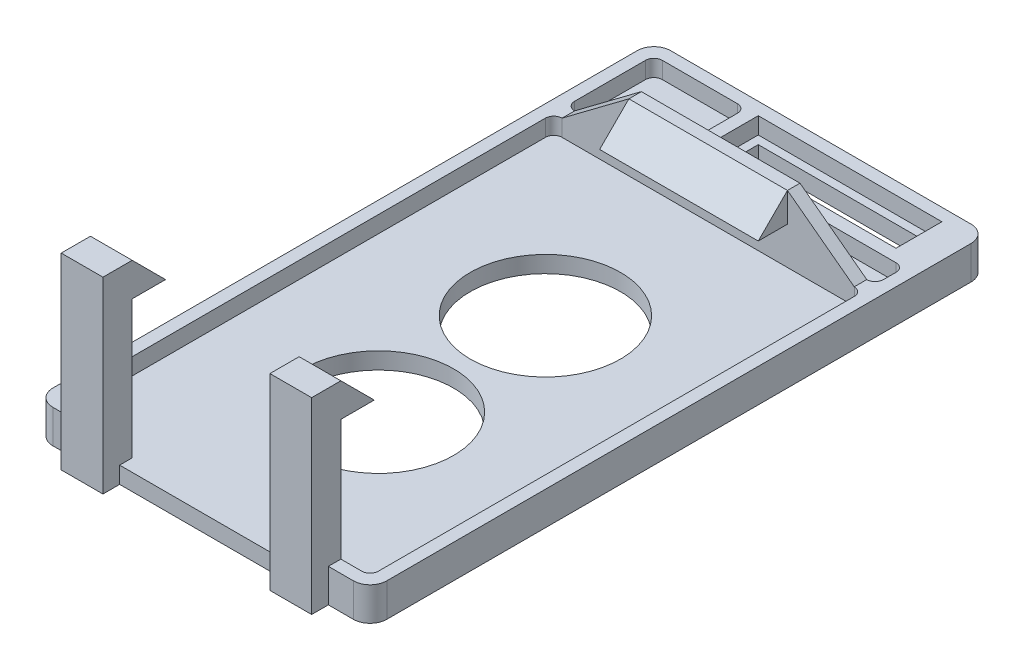
from build123d import *

# Parameters (mm, degrees)
BOSS_EXTRUDE1_DEPTH  = 1
PCB_HOLDER_52_R      = 4.5
BOSS_EXTRUDE2_DEPTH  = 1
BOSS_EXTRUDE3_DEPTH  = 2
PCB_HOLDER_57_W      = 17.5
PCB_HOLDER_57_H      = 0.75
BOSS_EXTRUDE7_DEPTH  = 5
SKETCH6_W            = 9.5
SKETCH6_H            = 1.75
BOSS_EXTRUDE9_DEPTH  = 1.75
CUT_EXTRUDE7_DEPTH   = 0.75
PCB_HOLDER_58_W      = 2.5
PCB_HOLDER_58_H      = 1
PCB_HOLDER_58_H_2    = 0.75
BOSS_EXTRUDE10_DEPTH = 11.25
SKETCH10_W           = 2.5
SKETCH10_H           = 2
BOSS_EXTRUDE11_DEPTH = 2
CUT_EXTRUDE8_DEPTH   = 15
CUT_EXTRUDE12_DEPTH  = 9.5
SKETCH12_W           = 11
SKETCH12_H           = 2.75
SKETCH12_W_2         = 10
SKETCH12_H_2         = 1.75
CUT_EXTRUDE15_DEPTH  = 1
SKETCH12_3_W         = 10
SKETCH12_3_H         = 1.75
CUT_EXTRUDE16_DEPTH  = 2


with BuildPart() as part:
    # PCB holder → Boss-Extrude1 (new body)
    with BuildSketch(Plane(origin=(0, 0, 0), x_dir=(1, 0, 0), z_dir=(0, 1, 0))):
        with BuildLine():
            Line((9, 21.5), (-9, 21.5))
            ThreePointArc((-9, 21.5), (-9.707106781, 21.207106781), (-10, 20.5))
            Line((-10, 20.5), (-10, -14.5))
            ThreePointArc((-10, -14.5), (-9.707106781, -15.207106781), (-9, -15.5))
            Line((-9, -15.5), (9, -15.5))
            ThreePointArc((9, -15.5), (9.707106781, -15.207106781), (10, -14.5))
            Line((10, -14.5), (10, 20.5))
            ThreePointArc((10, 20.5), (9.707106781, 21.207106781), (9, 21.5))
        make_face()
        with BuildLine():
            Line((9.25, 14.25), (9.25, -14.25))
            ThreePointArc((9.25, -14.25), (9.103553391, -14.603553391), (8.75, -14.75))
            Line((8.75, -14.75), (-8.75, -14.75))
            ThreePointArc((-8.75, -14.75), (-9.103553391, -14.603553391), (-9.25, -14.25))
            Line((-9.25, -14.25), (-9.25, 14.25))
            ThreePointArc((-9.25, 14.25), (-9.103553391, 14.603553391), (-8.75, 14.75))
            Line((-8.75, 14.75), (8.75, 14.75))
            ThreePointArc((8.75, 14.75), (9.103553391, 14.603553391), (9.25, 14.25))
        make_face(mode=Mode.SUBTRACT)
    extrude(amount=BOSS_EXTRUDE1_DEPTH)

    # PCB holder<52> → Boss-Extrude2 (add)
    with BuildSketch(Plane(origin=(0, 0, 0), x_dir=(1, 0, 0), z_dir=(0, 1, 0))):
        with BuildLine():
            Line((-9.25, 14.25), (-9.25, -14.25))
            ThreePointArc((-9.25, -14.25), (-9.103553391, -14.603553391), (-8.75, -14.75))
            Line((-8.75, -14.75), (8.75, -14.75))
            ThreePointArc((8.75, -14.75), (9.103553391, -14.603553391), (9.25, -14.25))
            Line((9.25, -14.25), (9.25, 14.25))
            ThreePointArc((9.25, 14.25), (9.103553391, 14.603553391), (8.75, 14.75))
            Line((8.75, 14.75), (-8.75, 14.75))
            ThreePointArc((-8.75, 14.75), (-9.103553391, 14.603553391), (-9.25, 14.25))
        make_face()
        with Locations(Location((0, -5, 0), (0, 0, 270))):
            Circle(PCB_HOLDER_52_R, mode=Mode.SUBTRACT)
        with Locations(Location((0, 5, 0), (0, 0, 270))):
            Circle(PCB_HOLDER_52_R, mode=Mode.SUBTRACT)
    extrude(amount=BOSS_EXTRUDE2_DEPTH)

    # PCB holder<55> → Boss-Extrude3 (add)
    with BuildSketch(Plane(origin=(0, 0, 0), x_dir=(1, 0, 0), z_dir=(0, 1, 0))):
        with BuildLine():
            Line((8.75, 15.5), (8.75, 14.75))
            ThreePointArc((8.75, 14.75), (9.103553391, 14.603553391), (9.25, 14.25))
            Line((9.25, 14.25), (9.25, -14.25))
            ThreePointArc((9.25, -14.25), (9.103553391, -14.603553391), (8.75, -14.75))
            Line((8.75, -14.75), (7.5, -14.75))
            Line((7.5, -14.75), (7.5, -15.5))
            Line((7.5, -15.5), (9, -15.5))
            ThreePointArc((9, -15.5), (9.707106781, -15.207106781), (10, -14.5))
            Line((10, -14.5), (10, 20.5))
            ThreePointArc((10, 20.5), (9.707106781, 21.207106781), (9, 21.5))
            Line((9, 21.5), (-9, 21.5))
            ThreePointArc((-9, 21.5), (-9.707106781, 21.207106781), (-10, 20.5))
            Line((-10, 20.5), (-10, -14.5))
            ThreePointArc((-10, -14.5), (-9.707106781, -15.207106781), (-9, -15.5))
            Line((-9, -15.5), (-7.5, -15.5))
            Line((-7.5, -15.5), (-7.5, -14.75))
            Line((-7.5, -14.75), (-8.75, -14.75))
            ThreePointArc((-8.75, -14.75), (-9.103553391, -14.603553391), (-9.25, -14.25))
            Line((-9.25, -14.25), (-9.25, 14.25))
            ThreePointArc((-9.25, 14.25), (-9.103553391, 14.603553391), (-8.75, 14.75))
            Line((-8.75, 14.75), (-8.75, 15.5))
            Line((-8.75, 15.5), (8.75, 15.5))
        make_face()
    extrude(amount=BOSS_EXTRUDE3_DEPTH)

    # PCB holder<57> → Boss-Extrude7 (add)
    with BuildSketch(Plane(origin=(0, 0, 0), x_dir=(1, 0, 0), z_dir=(0, 1, 0))):
        with Locations((0, 15.125)):
            Rectangle(PCB_HOLDER_57_W, PCB_HOLDER_57_H)
    extrude(amount=BOSS_EXTRUDE7_DEPTH)

    # Sketch6 → Boss-Extrude9 (add)
    with BuildSketch(Plane.XY.offset(-14.75)):
        with Locations((0, 4.125)):
            Rectangle(SKETCH6_W, SKETCH6_H)
    extrude(amount=BOSS_EXTRUDE9_DEPTH)

    # Sketch8 → Cut-Extrude7 (cut)
    with BuildSketch(Plane.XY.offset(-14.75)):
        Polygon((4.75, 5), (8.75, 2), (8.75, 5), align=None)
        Polygon((-4.75, 5), (-8.75, 2), (-8.75, 5), align=None)
    extrude(amount=-CUT_EXTRUDE7_DEPTH, mode=Mode.SUBTRACT)

    # PCB holder<58> → Boss-Extrude10 (add)
    with BuildSketch(Plane(origin=(0, 0, 0), x_dir=(1, 0, 0), z_dir=(0, 1, 0))):
        with Locations((-6.25, -16)):
            Rectangle(PCB_HOLDER_58_W, PCB_HOLDER_58_H)
        with Locations((-6.25, -15.125)):
            Rectangle(PCB_HOLDER_58_W, PCB_HOLDER_58_H_2)
        with Locations((6.25, -16)):
            Rectangle(PCB_HOLDER_58_W, PCB_HOLDER_58_H)
        with Locations((6.25, -15.125)):
            Rectangle(PCB_HOLDER_58_W, PCB_HOLDER_58_H_2)
    extrude(amount=BOSS_EXTRUDE10_DEPTH)

    # Sketch10 → Boss-Extrude11 (add)
    with BuildSketch(Plane(origin=(0, 0, 14.75), x_dir=(-1, 0, 0), z_dir=(0, 0, -1))):
        with Locations((-6.25, 10.25)):
            Rectangle(SKETCH10_W, SKETCH10_H)
        with Locations((6.25, 10.25)):
            Rectangle(SKETCH10_W, SKETCH10_H)
    extrude(amount=BOSS_EXTRUDE11_DEPTH)

    # Sketch11 → Cut-Extrude8 (cut)
    with BuildSketch(Plane(origin=(7.5, 0, 0), x_dir=(0, 0, -1), z_dir=(1, 0, 0))):
        Polygon((-14.75, 11.25), (-12.75, 9.25), (-12.75, 11.25), align=None)
    extrude(amount=-CUT_EXTRUDE8_DEPTH, mode=Mode.SUBTRACT)

    # Sketch7 → Cut-Extrude12 (cut)
    with BuildSketch(Plane(origin=(4.75, 0, 0), x_dir=(0, 0, -1), z_dir=(1, 0, 0))):
        Polygon((13, 3.25), (14.75, 5), (13, 5), align=None)
    extrude(amount=-CUT_EXTRUDE12_DEPTH, mode=Mode.SUBTRACT)

    # Sketch12 → Cut-Extrude15 (cut)
    # profile 1 of 2: a face of its own
    with BuildSketch(Plane(origin=(0, 2, 0), x_dir=(1, 0, 0), z_dir=(0, 1, 0))):
        with BuildLine():
            Line((9.25, 16), (9.25, 16.75))
            ThreePointArc((9.25, 16.75), (9.103553391, 17.103553391), (8.75, 17.25))
            Line((8.75, 17.25), (-3.25, 17.25))
            ThreePointArc((-3.25, 17.25), (-3.603553391, 17.396446609), (-3.75, 17.75))
            Line((-3.75, 17.75), (-3.75, 20.25))
            ThreePointArc((-3.75, 20.25), (-3.896446609, 20.603553391), (-4.25, 20.75))
            Line((-4.25, 20.75), (-8.75, 20.75))
            ThreePointArc((-8.75, 20.75), (-9.103553391, 20.603553391), (-9.25, 20.25))
            Line((-9.25, 20.25), (-9.25, 16))
            ThreePointArc((-9.25, 16), (-9.103553391, 15.646446609), (-8.75, 15.5))
            Line((-8.75, 15.5), (8.75, 15.5))
            ThreePointArc((8.75, 15.5), (9.103553391, 15.646446609), (9.25, 16))
        make_face()
    # profile 2 of 2: a face of its own
    with BuildSketch(Plane(origin=(0, 2, 0), x_dir=(1, 0, 0), z_dir=(0, 1, 0))):
        with Locations((2.5, 19.375)):
            Rectangle(SKETCH12_W, SKETCH12_H)
        with Locations((2.5, 19.375)):
            Rectangle(SKETCH12_W_2, SKETCH12_H_2, mode=Mode.SUBTRACT)
    extrude(amount=-CUT_EXTRUDE15_DEPTH, mode=Mode.SUBTRACT)

    # Sketch12<3> → Cut-Extrude16 (cut)
    with BuildSketch(Plane(origin=(0, 2, 0), x_dir=(1, 0, 0), z_dir=(0, 1, 0))):
        with Locations((2.5, 19.375)):
            Rectangle(SKETCH12_3_W, SKETCH12_3_H)
    extrude(amount=-CUT_EXTRUDE16_DEPTH, mode=Mode.SUBTRACT)


solid = part.part
